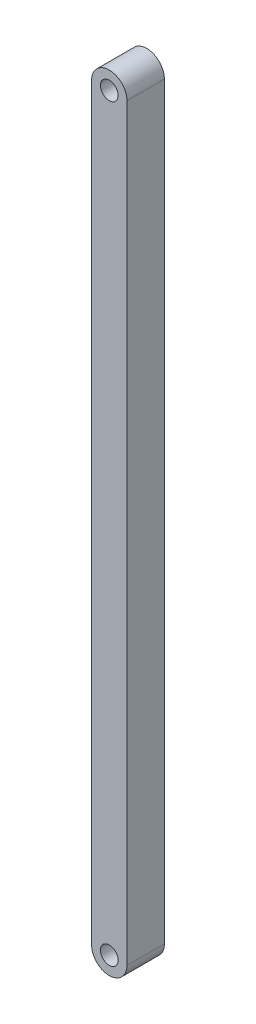
from build123d import *

# Parameters (mm, degrees)
SKETCH1_R           = 3
BOSS_EXTRUDE1_DEPTH = 12.7


with BuildPart() as part:
    # Sketch1 → Boss-Extrude1 (new body)
    with BuildSketch(Plane.XY):
        with BuildLine():
            Line((-6, -254), (-6, 0))
            ThreePointArc((-6, 0), (0, 6), (6, 0))
            Line((6, 0), (6, -254))
            ThreePointArc((6, -254), (0, -260), (-6, -254))
        make_face()
        Circle(SKETCH1_R, mode=Mode.SUBTRACT)
        with Locations((0, -254)):
            Circle(SKETCH1_R, mode=Mode.SUBTRACT)
    extrude(amount=BOSS_EXTRUDE1_DEPTH)


solid = part.part
